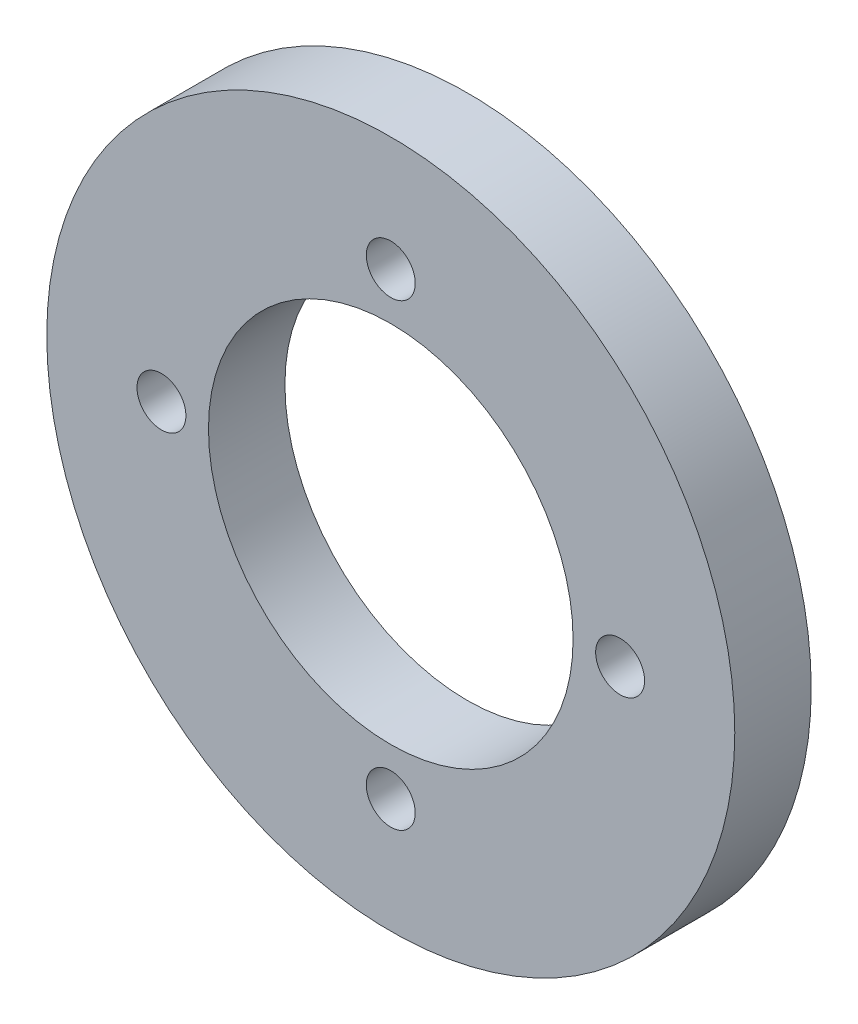
from build123d import *

# Parameters (mm, degrees)
SKETCH1_R           = 22.5
SKETCH1_R_2         = 1.6
SKETCH1_R_3         = 11.923692715
BOSS_EXTRUDE1_DEPTH = 5


with BuildPart() as part:
    # Sketch1 → Boss-Extrude1 (new body)
    with BuildSketch(Plane.XY):
        Circle(SKETCH1_R)
        with Locations((0, 15)):
            Circle(SKETCH1_R_2, mode=Mode.SUBTRACT)
        with Locations((15, 0)):
            Circle(SKETCH1_R_2, mode=Mode.SUBTRACT)
        with Locations((0, -15)):
            Circle(SKETCH1_R_2, mode=Mode.SUBTRACT)
        with Locations((-15, 0)):
            Circle(SKETCH1_R_2, mode=Mode.SUBTRACT)
        Circle(SKETCH1_R_3, mode=Mode.SUBTRACT)
    extrude(amount=BOSS_EXTRUDE1_DEPTH)


solid = part.part
